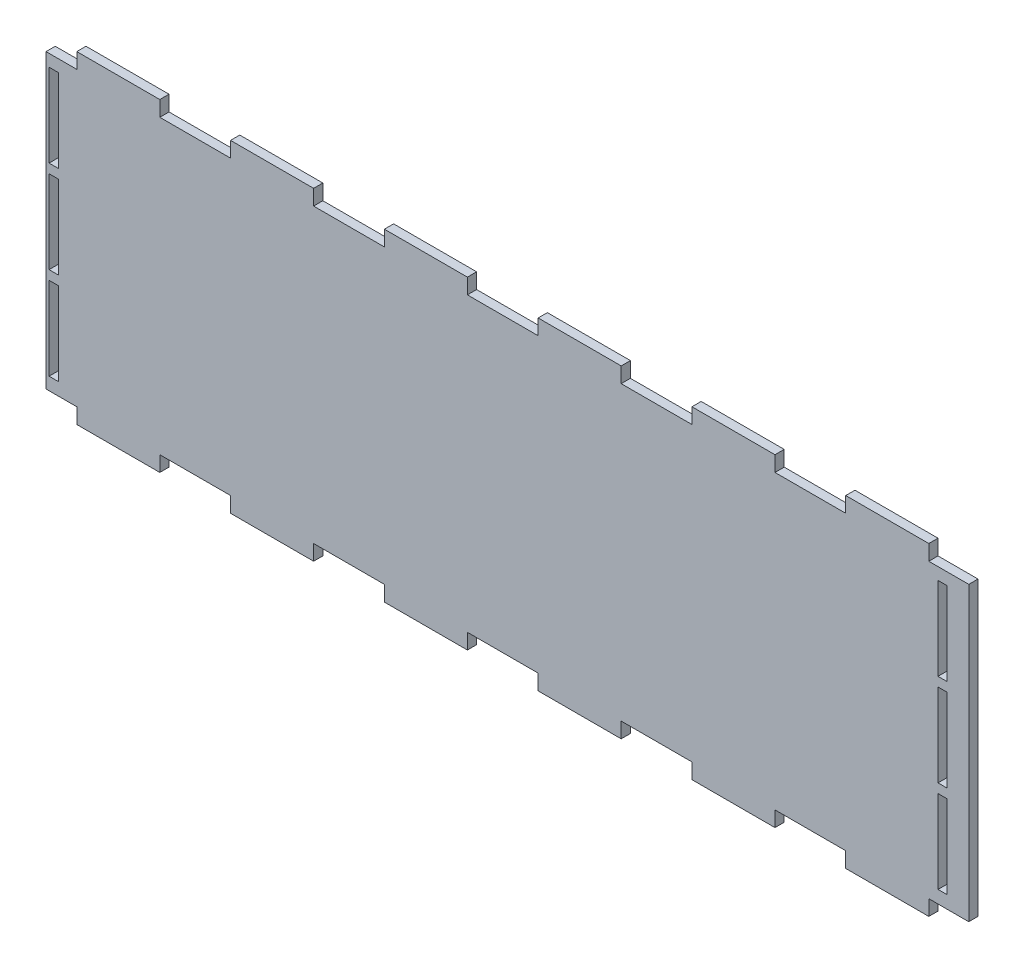
from build123d import *

# Parameters (mm, degrees)
SKETCH1_W           = 3
SKETCH1_H           = 27
BOSS_EXTRUDE1_DEPTH = 3
SKETCH2_W           = 3
SKETCH2_H           = 27
CUT_EXTRUDE1_DEPTH  = 10
SKETCH3_W           = 27
SKETCH3_H           = 5
BOSS_EXTRUDE3_DEPTH = 3


with BuildPart() as part:
    # Sketch1 → Boss-Extrude1 (new body)
    with BuildSketch(Plane.XY):
        Polygon((-90, 52.5), (-90, 47.5), (-113, 47.5), (-113, 52.5), (-140, 52.5), (-140, 47.5), (-150, 47.5), (-150, -47.5), (150, -47.5), (150, 47.5), (137, 47.5), (137, 52.5), (110, 52.5), (110, 47.5), (87, 47.5), (87, 52.5), (60, 52.5), (60, 47.5), (37, 47.5), (37, 52.5), (10, 52.5), (10, 47.5), (-13, 47.5), (-13, 52.5), (-40, 52.5), (-40, 47.5), (-63, 47.5), (-63, 52.5), align=None)
        with Locations((-147.5, 30.102605219)):
            Rectangle(SKETCH1_W, SKETCH1_H, mode=Mode.SUBTRACT)
        with Locations((-147.5, -29.897394781)):
            Rectangle(SKETCH1_W, SKETCH1_H, mode=Mode.SUBTRACT)
        with Locations((-147.5, 0.102605219)):
            Rectangle(SKETCH1_W, SKETCH1_H, mode=Mode.SUBTRACT)
    extrude(amount=BOSS_EXTRUDE1_DEPTH)

    # Sketch2 → Cut-Extrude1 (cut)
    with BuildSketch(Plane.XY.offset(3)):
        with Locations((141.5, 30.1)):
            Rectangle(SKETCH2_W, SKETCH2_H)
        with Locations((141.5, 0.1)):
            Rectangle(SKETCH2_W, SKETCH2_H)
        with Locations((141.5, -29.9)):
            Rectangle(SKETCH2_W, SKETCH2_H)
    extrude(amount=-CUT_EXTRUDE1_DEPTH, mode=Mode.SUBTRACT)

    # Sketch3 → Boss-Extrude3 (add)
    with BuildSketch(Plane.XY.offset(3)):
        with Locations((-126.5, -50)):
            Rectangle(SKETCH3_W, SKETCH3_H)
        with Locations((-76.5, -50)):
            Rectangle(SKETCH3_W, SKETCH3_H)
        with Locations((-26.5, -50)):
            Rectangle(SKETCH3_W, SKETCH3_H)
        with Locations((23.5, -50)):
            Rectangle(SKETCH3_W, SKETCH3_H)
        with Locations((73.5, -50)):
            Rectangle(SKETCH3_W, SKETCH3_H)
        with Locations((123.5, -50)):
            Rectangle(SKETCH3_W, SKETCH3_H)
    extrude(amount=-BOSS_EXTRUDE3_DEPTH)


solid = part.part
